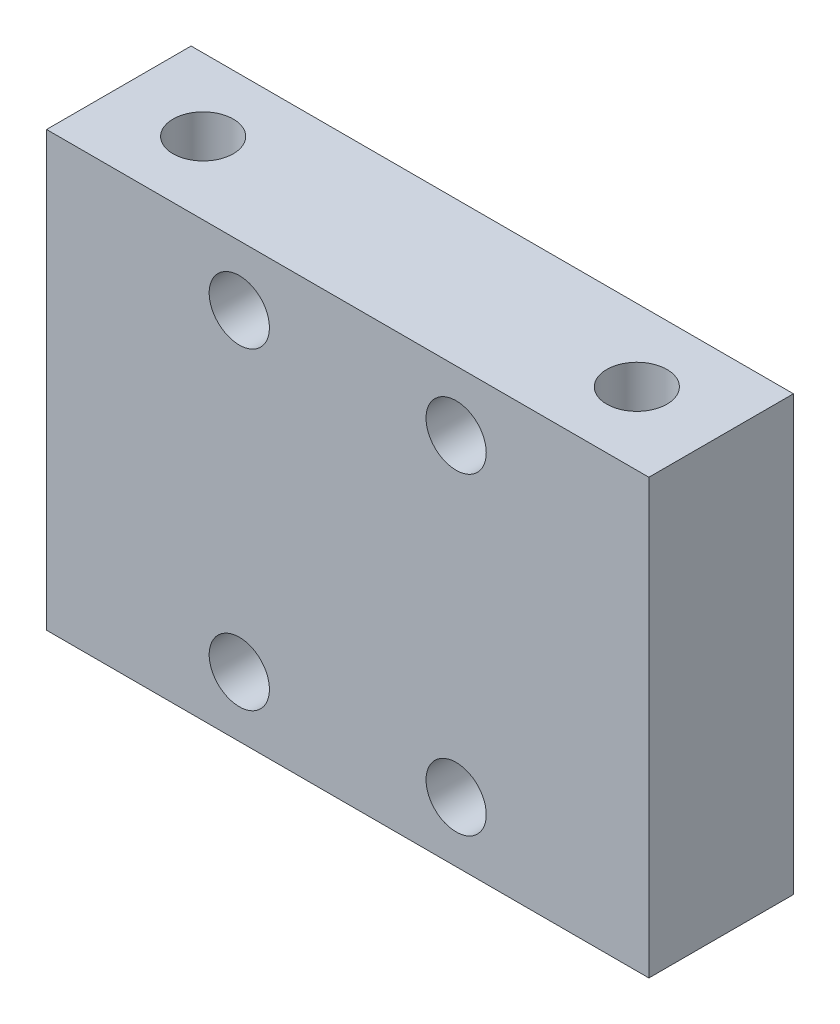
from build123d import *

# Parameters (mm, degrees)
SKETCH_1_W             = 25
SKETCH_1_H             = 18
EXTRUDE_1_DEPTH        = 3
HOLE_WIZARD_M3_1_D     = 2.5
HOLE_WIZARD_M3_2_D     = 2.5
HOLE_WIZARD_M3_2_DEPTH = 8.5
HOLE_WIZARD_M3_2_TIP   = 0.751075774


with BuildPart() as part:
    # 草图1 → 凸台-拉伸1 (new, symmetric)
    with BuildSketch(Plane.XY):
        Rectangle(SKETCH_1_W, SKETCH_1_H)
    extrude(amount=EXTRUDE_1_DEPTH, both=True)

    # M3 螺纹孔1 (through all)
    with Locations(Plane(origin=(0, 9, 0), x_dir=(1, 0, 0), z_dir=(0, 1, 0))):
        with Locations((-9, 0), (9, 0)):
            Hole(HOLE_WIZARD_M3_1_D / 2)

    # M3 螺纹孔2
    with Locations(Plane.XY.offset(3)):
        with Locations((-4.5, -6.5), (4.5, -6.5), (4.5, 6.5), (-4.5, 6.5)):
            Hole(HOLE_WIZARD_M3_2_D / 2, depth=HOLE_WIZARD_M3_2_DEPTH)
            with Locations((0, 0, -(HOLE_WIZARD_M3_2_DEPTH + HOLE_WIZARD_M3_2_TIP / 2))):  # 118° drill point
                Cone(0, HOLE_WIZARD_M3_2_D / 2, HOLE_WIZARD_M3_2_TIP, mode=Mode.SUBTRACT)


solid = part.part
